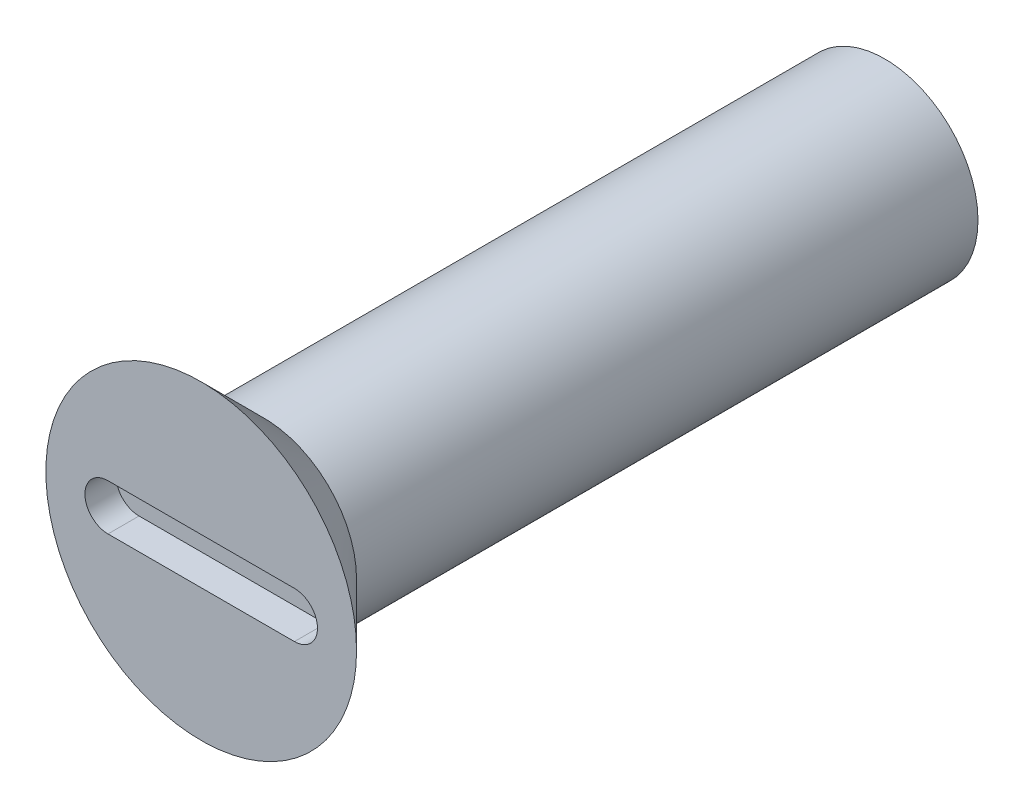
from build123d import *

# Parameters (mm, degrees)
SKETCH1_R           = 1.5
BOSS_EXTRUDE1_DEPTH = 10
CUT_EXTRUDE1_DEPTH  = 0.5


with BuildPart() as part:
    # Sketch1 → Boss-Extrude1 (new body)
    with BuildSketch(Plane.XY):
        Circle(SKETCH1_R)
    extrude(amount=BOSS_EXTRUDE1_DEPTH)

    # Sketch3 → Revolve1 (revolve)
    with BuildSketch(Plane(origin=(0, 0, 0), x_dir=(1, 0, 0), z_dir=(0, 1, 0)), mode=Mode.PRIVATE) as revolve1_sk:
        Polygon((-1.5, -10), (-2.5, -11), (0, -11), (0, -10), align=None)
    revolve(revolve1_sk.sketch.rotate(Axis((0, 0, 11), (0, 0, -1)), 180), axis=Axis((0, 0, 11), (0, 0, -1)))

    # Sketch4 → Cut-Extrude1 (cut)
    with BuildSketch(Plane.XY.offset(11)):
        with BuildLine():
            Line((-1.5, 0.37089394), (1.5, 0.37089394))
            ThreePointArc((1.5, 0.37089394), (1.87089394, 0), (1.5, -0.37089394))
            Line((1.5, -0.37089394), (-1.5, -0.37089394))
            ThreePointArc((-1.5, -0.37089394), (-1.87089394, 0), (-1.5, 0.37089394))
        make_face()
    extrude(amount=-CUT_EXTRUDE1_DEPTH, mode=Mode.SUBTRACT)


solid = part.part
